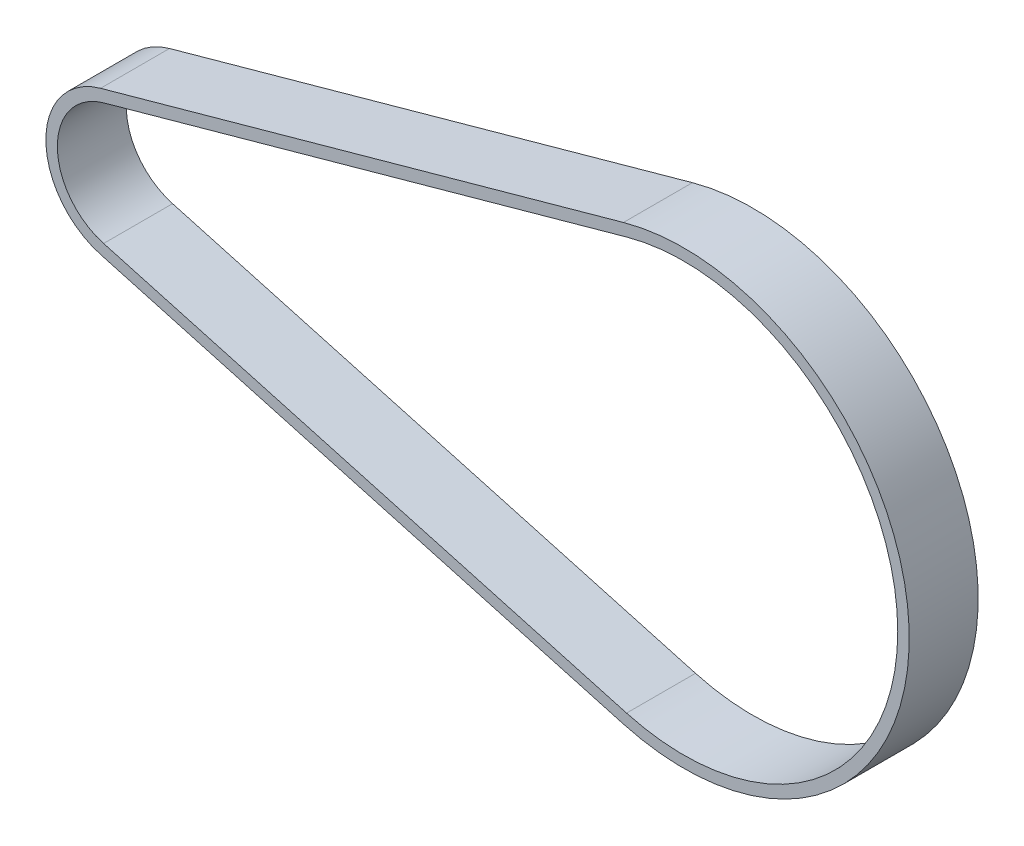
from build123d import *

# Parameters (mm, degrees)
SALIENTE_EXTRUIR1_DEPTH = 6


with BuildPart() as part:
    # Croquis1 → Saliente-Extruir1 (new body)
    with BuildSketch(Plane.XY):
        with BuildLine():
            Line((-1.739698082, 6.26286281), (43.76878825, 18.904210514))
            ThreePointArc((43.76878825, 18.904210514), (68.64, 0), (43.76878825, -18.904210514))
            Line((43.76878825, -18.904210514), (-1.739698082, -6.26286281))
            ThreePointArc((-1.739698082, -6.26286281), (-6.5, 0), (-1.739698082, 6.26286281))
        make_face()
        with BuildLine():
            Line((-1.472052224, 5.299345455), (44.036434109, 17.940693158))
            ThreePointArc((44.036434109, 17.940693158), (67.64, 0), (44.036434109, -17.940693158))
            Line((44.036434109, -17.940693158), (-1.472052224, -5.299345455))
            ThreePointArc((-1.472052224, -5.299345455), (-5.5, 0), (-1.472052224, 5.299345455))
        make_face(mode=Mode.SUBTRACT)
    extrude(amount=SALIENTE_EXTRUIR1_DEPTH)


solid = part.part
